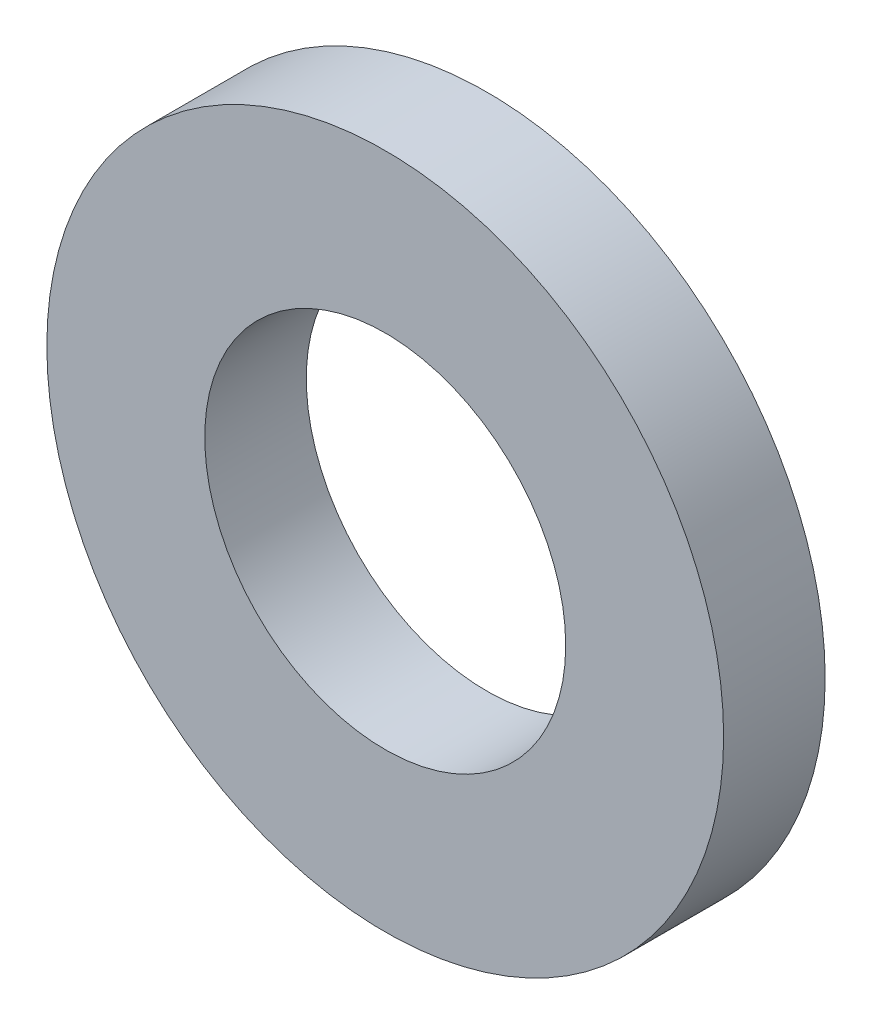
from build123d import *

# Parameters (mm, degrees)
ESQUISSE1_R        = 6
ESQUISSE1_R_2      = 3.2
BOSS_EXTRU_1_DEPTH = 1.8


with BuildPart() as part:
    # Esquisse1 → Boss.-Extru.1 (new body)
    with BuildSketch(Plane.XY):
        Circle(ESQUISSE1_R)
        Circle(ESQUISSE1_R_2, mode=Mode.SUBTRACT)
    extrude(amount=BOSS_EXTRU_1_DEPTH)


solid = part.part
